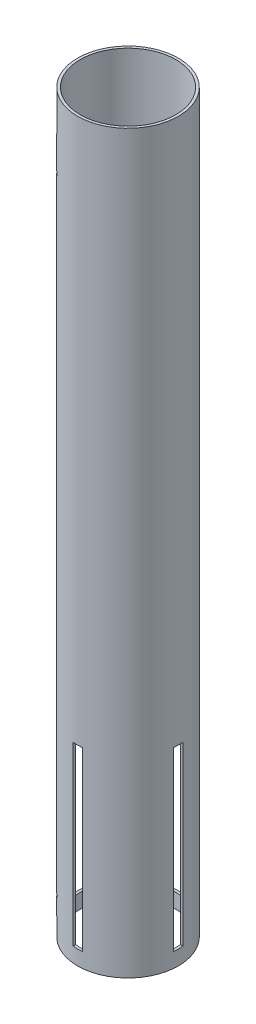
from build123d import *

# Parameters (mm, degrees)
SKETCH1_R                       = 34.25
SKETCH1_R_2                     = 32.5
BULK_DEPTH                      = 500
SKETCH2_R                       = 1.75
LAUNCH_LUG_SCREW_HOLES_DEPTH    = 503.340646375
SKETCH3_W                       = 6.5
SKETCH3_H                       = 120
THRU_WALL_FIN_CUTS_DEPTH        = 503.340646488
THRU_WALL_FIN_CUT_PATTERN_COUNT = 2
THRU_WALL_FIN_CUT_PATTERN_ANGLE = 90


with BuildPart() as part:
    # Sketch1 → BULK (new body)
    with BuildSketch(Plane(origin=(0, 0, 0), x_dir=(1, 0, 0), z_dir=(0, 1, 0))):
        Circle(SKETCH1_R)
        Circle(SKETCH1_R_2, mode=Mode.SUBTRACT)
    extrude(amount=BULK_DEPTH)

    # Sketch2 → LAUNCH LUG SCREW HOLES (cut, through all)
    with BuildSketch(Plane(origin=(0, 0, 0), x_dir=(0.7071067811865477, 0, 0.7071067811865475), z_dir=(-0.7071067811865475, 0, 0.7071067811865477))):
        with Locations((0, 25)):
            Circle(SKETCH2_R)
        with Locations((0, 450)):
            Circle(SKETCH2_R)
    extrude(amount=LAUNCH_LUG_SCREW_HOLES_DEPTH, mode=Mode.SUBTRACT)

    # Sketch3 → THRU WALL FIN CUTS (cut, symmetric)
    with BuildSketch(Plane.XY):
        with Locations((0, 70)):
            Rectangle(SKETCH3_W, SKETCH3_H)
    thru_wall_fin_cuts = extrude(amount=THRU_WALL_FIN_CUTS_DEPTH, both=True, mode=Mode.SUBTRACT)

    # THRU WALL FIN CUT PATTERN: THRU WALL FIN CUTS ×2 about axis
    thru_wall_fin_cut_pattern_axis = Axis((0, -25, 0), (0, 1, 0))
    for i in range(1, THRU_WALL_FIN_CUT_PATTERN_COUNT):
        add(thru_wall_fin_cuts.rotate(thru_wall_fin_cut_pattern_axis, i * THRU_WALL_FIN_CUT_PATTERN_ANGLE / (THRU_WALL_FIN_CUT_PATTERN_COUNT - 1)), mode=Mode.SUBTRACT)


solid = part.part
